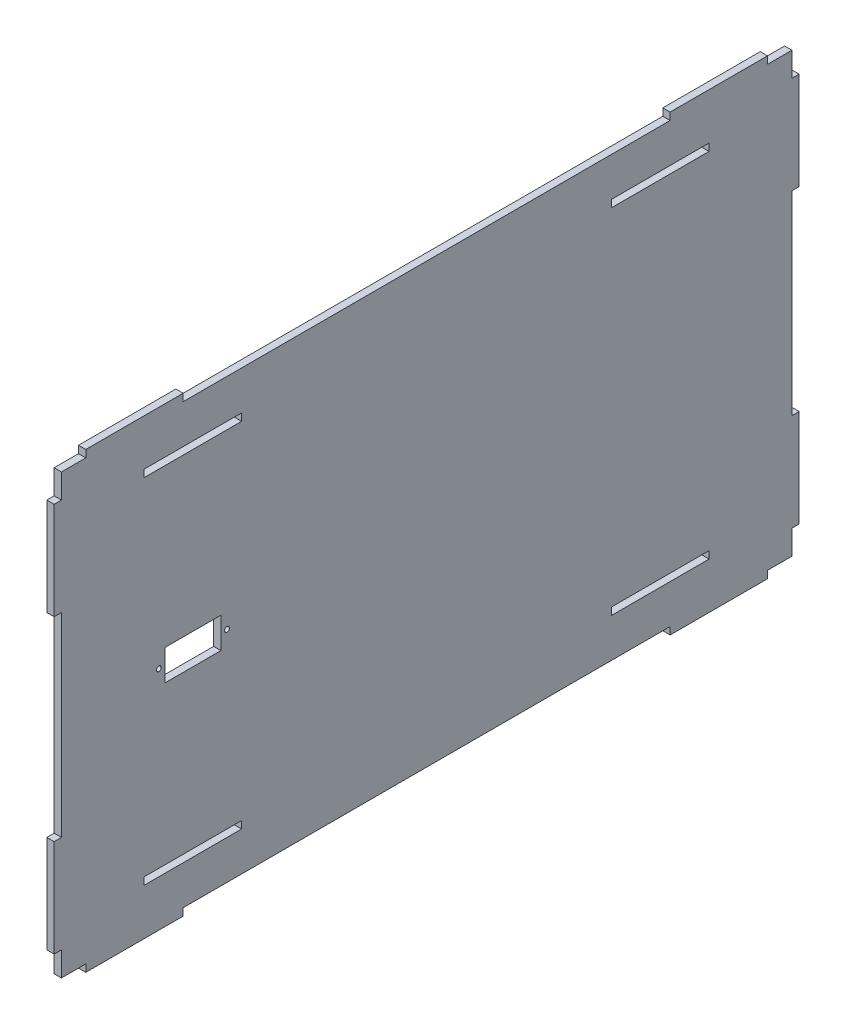
from build123d import *

# Parameters (mm, degrees)
SKETCH1_W           = 300
SKETCH1_H           = 180
BOSS_EXTRUDE1_DEPTH = 3
SKETCH2_W           = 40
SKETCH2_H           = 3
SKETCH2_W_2         = 3
SKETCH2_H_2         = 40
BOSS_EXTRUDE2_DEPTH = 3
SKETCH3_W           = 40
SKETCH3_H           = 3
CUT_EXTRUDE1_DEPTH  = 354.987287907
SKETCH4_W           = 40
SKETCH4_H           = 3
CUT_EXTRUDE2_DEPTH  = 3
SKETCH5_W           = 40
SKETCH5_H           = 3
CUT_EXTRUDE3_DEPTH  = 3
SKETCH6_W           = 40
SKETCH6_H           = 3
CUT_EXTRUDE4_DEPTH  = 3
SKETCH8_W           = 23.03
SKETCH8_H           = 12.59
CUT_EXTRUDE5_DEPTH  = 10
SKETCH9_R           = 1
CUT_EXTRUDE6_DEPTH  = 2
SKETCH12_R          = 1.5
CUT_EXTRUDE7_DEPTH  = 10
SKETCH13_R          = 1.5
CUT_EXTRUDE8_DEPTH  = 10


with BuildPart() as part:
    # Sketch1 → Boss-Extrude1 (new body)
    with BuildSketch(Plane(origin=(0, 0, 0), x_dir=(0, 0, -1), z_dir=(1, 0, 0))):
        with Locations((-150, 90)):
            Rectangle(SKETCH1_W, SKETCH1_H)
    extrude(amount=BOSS_EXTRUDE1_DEPTH)

    # Sketch2 → Boss-Extrude2 (add)
    with BuildSketch(Plane(origin=(3, 0, 0), x_dir=(0, 0, -1), z_dir=(1, 0, 0))):
        with Locations((-270, 181.5)):
            Rectangle(SKETCH2_W, SKETCH2_H)
        with Locations((-30, 181.5)):
            Rectangle(SKETCH2_W, SKETCH2_H)
        with Locations((1.5, 150)):
            Rectangle(SKETCH2_W_2, SKETCH2_H_2)
        with Locations((1.5, 30)):
            Rectangle(SKETCH2_W_2, SKETCH2_H_2)
        with Locations((-30, -1.5)):
            Rectangle(SKETCH2_W, SKETCH2_H)
        with Locations((-270, -1.5)):
            Rectangle(SKETCH2_W, SKETCH2_H)
        with Locations((-301.5, 150)):
            Rectangle(SKETCH2_W_2, SKETCH2_H_2)
        with Locations((-301.5, 30)):
            Rectangle(SKETCH2_W_2, SKETCH2_H_2)
    extrude(amount=-BOSS_EXTRUDE2_DEPTH)

    # Sketch3 → Cut-Extrude1 (cut, through all)
    with BuildSketch(Plane(origin=(3, 0, 0), x_dir=(0, 0, -1), z_dir=(1, 0, 0))):
        with Locations((-246, 162.5)):
            Rectangle(SKETCH3_W, SKETCH3_H)
    extrude(amount=-CUT_EXTRUDE1_DEPTH, mode=Mode.SUBTRACT)

    # Sketch4 → Cut-Extrude2 (cut)
    with BuildSketch(Plane(origin=(3, 0, 0), x_dir=(0, 0, -1), z_dir=(1, 0, 0))):
        with Locations((-54, 162.5)):
            Rectangle(SKETCH4_W, SKETCH4_H)
    extrude(amount=-CUT_EXTRUDE2_DEPTH, mode=Mode.SUBTRACT)

    # Sketch5 → Cut-Extrude3 (cut)
    with BuildSketch(Plane(origin=(3, 0, 0), x_dir=(0, 0, -1), z_dir=(1, 0, 0))):
        with Locations((-246, 17.5)):
            Rectangle(SKETCH5_W, SKETCH5_H)
    extrude(amount=-CUT_EXTRUDE3_DEPTH, mode=Mode.SUBTRACT)

    # Sketch6 → Cut-Extrude4 (cut)
    with BuildSketch(Plane(origin=(3, 0, 0), x_dir=(0, 0, -1), z_dir=(1, 0, 0))):
        with Locations((-54, 17.5)):
            Rectangle(SKETCH6_W, SKETCH6_H)
    extrude(amount=-CUT_EXTRUDE4_DEPTH, mode=Mode.SUBTRACT)

    # Sketch8 → Cut-Extrude5 (cut)
    with BuildSketch(Plane(origin=(3, 0, 0), x_dir=(0, 0, -1), z_dir=(1, 0, 0))):
        with Locations((-246, 90)):
            Rectangle(SKETCH8_W, SKETCH8_H)
    extrude(amount=-CUT_EXTRUDE5_DEPTH, mode=Mode.SUBTRACT)

    # Sketch9 → Cut-Extrude6 (cut)
    with BuildSketch(Plane(origin=(3, 0, 0), x_dir=(0, 0, -1), z_dir=(1, 0, 0))):
        with Locations((-260.015, 90)):
            Circle(SKETCH9_R)
        with Locations((-231.985, 90)):
            Circle(SKETCH9_R)
    extrude(amount=-CUT_EXTRUDE6_DEPTH, mode=Mode.SUBTRACT)

    # Sketch12 → Cut-Extrude7 (cut)
    with BuildSketch(Plane(origin=(1, 0, 0), x_dir=(0, 0, -1), z_dir=(1, 0, 0))):
        with Locations((-260.015, 90)):
            Circle(SKETCH12_R)
    extrude(amount=-CUT_EXTRUDE7_DEPTH, mode=Mode.SUBTRACT)

    # Sketch13 → Cut-Extrude8 (cut)
    with BuildSketch(Plane(origin=(1, 0, 0), x_dir=(0, 0, -1), z_dir=(1, 0, 0))):
        with Locations((-231.985, 90)):
            Circle(SKETCH13_R)
    extrude(amount=-CUT_EXTRUDE8_DEPTH, mode=Mode.SUBTRACT)


solid = part.part
